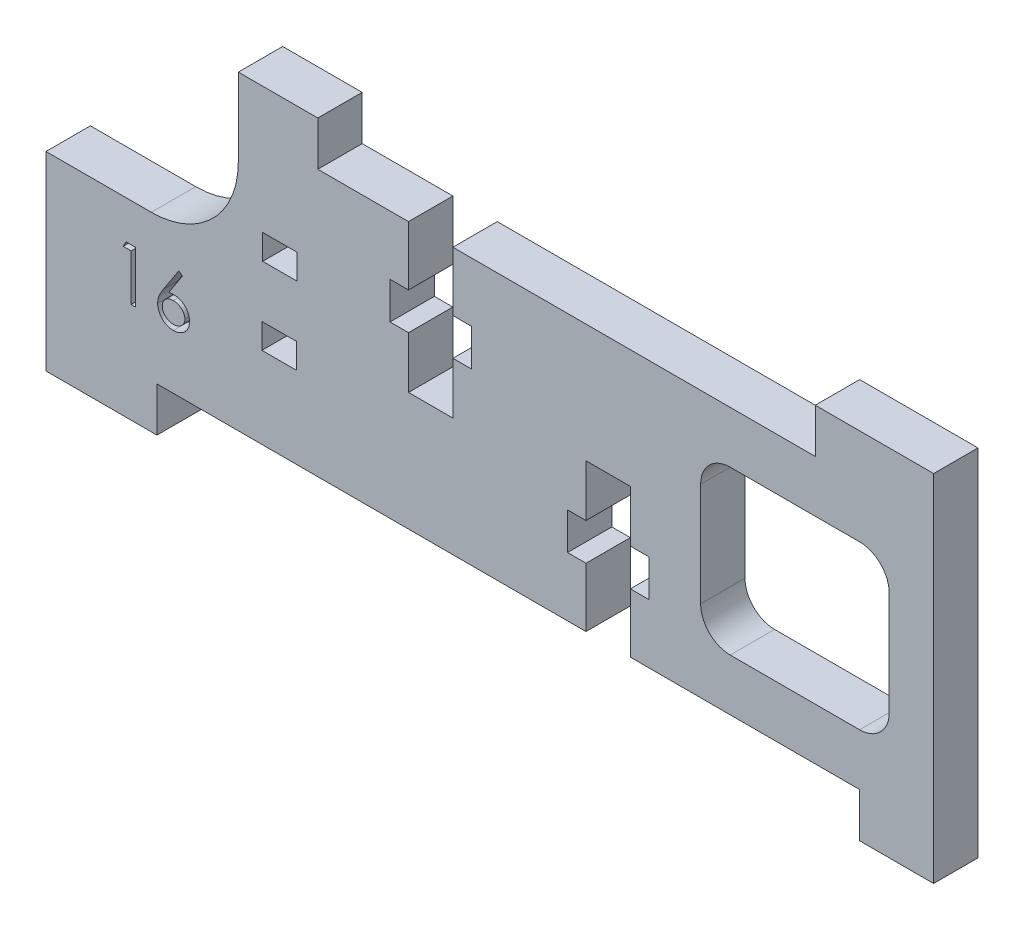
from build123d import *

# Parameters (mm, degrees)
SKETCH_1_W          = 2.3276
SKETCH_1_H          = 1.694
EXTRUDE_1_DEPTH     = 3
CUT_EXTRUDE_1_DEPTH = 1


with BuildPart() as part:
    # 草图1 → 凸台-拉伸1 (new body)
    with BuildSketch(Plane.XY.offset(3)):
        with BuildLine():
            Line((23.2531, 5.583631793), (24.503, 5.583631793))
            Line((24.503, 5.583631793), (24.503, 9.583631793))
            Line((24.503, 9.583631793), (18.3721, 9.583631793))
            Line((18.3721, 9.583631793), (18.3721, 12.583631793))
            Line((18.3721, 12.583631793), (12.9991, 12.583631793))
            Line((12.9991, 12.583631793), (12.9991, 7.316491962))
            ThreePointArc((12.9991, 7.316491962), (11.277392164, 3.159921553), (7.120821755, 1.438213717))
            Line((7.120821755, 1.438213717), (0, 1.438213717))
            Line((0, 1.438213717), (0, -11.416368207))
            Line((0, -11.416368207), (7.4994, -11.416368207))
            Line((7.4994, -11.416368207), (7.4994, -8.416368207))
            Line((7.4994, -8.416368207), (36.5002, -8.416368207))
            Line((36.5002, -8.416368207), (36.5002, -4.416368207))
            Line((36.5002, -4.416368207), (35.2489, -4.416368207))
            Line((35.2489, -4.416368207), (35.2489, -1.916368207))
            Line((35.2489, -1.916368207), (36.5002, -1.916368207))
            Line((36.5002, -1.916368207), (36.5002, 1.583631793))
            Line((36.5002, 1.583631793), (39.5003, 1.583631793))
            Line((39.5003, 1.583631793), (39.5003, -1.916368207))
            Line((39.5003, -1.916368207), (40.7501, -1.916368207))
            Line((40.7501, -1.916368207), (40.7501, -4.416368207))
            Line((40.7501, -4.416368207), (39.5003, -4.416368207))
            Line((39.5003, -4.416368207), (39.5003, -8.416368207))
            Line((39.5003, -8.416368207), (54.9988, -8.416368207))
            Line((54.9988, -8.416368207), (54.9988, -11.416368207))
            Line((54.9988, -11.416368207), (59.9998, -11.416368207))
            Line((59.9998, -11.416368207), (59.9998, 12.583631793))
            Line((59.9998, 12.583631793), (51.9988, 12.583631793))
            Line((51.9988, 12.583631793), (51.9988, 9.583631793))
            Line((51.9988, 9.583631793), (27.5031, 9.583631793))
            Line((27.5031, 9.583631793), (27.5031, 5.583631793))
            Line((27.5031, 5.583631793), (28.7543, 5.583631793))
            Line((28.7543, 5.583631793), (28.7543, 3.083631793))
            Line((28.7543, 3.083631793), (27.5031, 3.083631793))
            Line((27.5031, 3.083631793), (27.5031, -0.416368207))
            Line((27.5031, -0.416368207), (24.503, -0.416368207))
            Line((24.503, -0.416368207), (24.503, 3.083631793))
            Line((24.503, 3.083631793), (23.2531, 3.083631793))
            Line((23.2531, 3.083631793), (23.2531, 5.583631793))
        make_face()
        with BuildLine():
            Line((46.2504, 6.082631793), (54.9998, 6.082631793))
            ThreePointArc((54.9998, 6.082631793), (56.414013562, 5.496845355), (56.9998, 4.082631793))
            Line((56.9998, 4.082631793), (56.9998, -2.916368207))
            ThreePointArc((56.9998, -2.916368207), (56.414013562, -4.330581769), (54.9998, -4.916368207))
            Line((54.9998, -4.916368207), (46.2504, -4.916368207))
            ThreePointArc((46.2504, -4.916368207), (44.836186438, -4.330581769), (44.2504, -2.916368207))
            Line((44.2504, -2.916368207), (44.2504, 4.082631793))
            ThreePointArc((44.2504, 4.082631793), (44.836186438, 5.496845355), (46.2504, 6.082631793))
        make_face(mode=Mode.SUBTRACT)
        with Locations((15.811, 3.177631793)):
            Rectangle(SKETCH_1_W, SKETCH_1_H, mode=Mode.SUBTRACT)
        with Locations((15.7586, -2.060368207)):
            Rectangle(SKETCH_1_W, SKETCH_1_H, mode=Mode.SUBTRACT)
    extrude(amount=-EXTRUDE_1_DEPTH)

    # 草图2 → 切除-拉伸1 (cut)
    # profile 1 of 2: a face of its own
    with BuildSketch(Plane.XY.offset(3)):
        Polygon((5.418488838, -1.146310398), (6.065624255, -1.146310398), (6.065624255, -4.646310398), (5.75152169, -4.646310398), (5.75152169, -1.505284757), (5.213060152, -1.505284757), align=None)
    # profile 2 of 2: a face of its own
    with BuildSketch(Plane.XY.offset(3)):
        with BuildLine():
            Line((8.982290921, -1.056566809), (9.22417794, -1.246570815))
            Line((9.22417794, -1.246570815), (8.299398293, -2.660733475))
            add(Edge.make_bspline(
                [(8.299398293, -2.660733475), (8.36096857, -2.650919615), (8.481068357, -2.63177657), (8.602634255, -2.628618624), (8.661878261, -2.627079629)],
                knots=[0, 0, 0, 0, 1.025318673, 2, 2, 2, 2], degree=3))
            add(Edge.make_bspline(
                [(8.661878261, -2.627079629), (8.697450757, -2.628035741), (8.767474158, -2.629917818), (8.87028096, -2.644401669), (8.969069896, -2.667226781), (9.063431508, -2.700499037), (9.15370449, -2.743001391), (9.240406886, -2.793940261), (9.321908896, -2.855945942), (9.399260075, -2.925210897), (9.469487173, -3.001927882), (9.531663228, -3.083329219), (9.58389002, -3.1693301), (9.626263942, -3.259886966), (9.65916882, -3.354860225), (9.683156465, -3.454128365), (9.697336058, -3.557759836), (9.699261549, -3.628238011), (9.700239639, -3.664038764)],
                knots=[0, 0, 0, 0, 1.04369286, 2.054478336, 3.041073146, 4.015093852, 4.984733326, 5.965804835, 6.960378782, 7.985147595, 9.009457201, 10.008161701, 10.986880575, 11.956520048, 12.937015923, 13.931873656, 14.949455224, 16, 16, 16, 16], degree=3))
            add(Edge.make_bspline(
                [(9.700239639, -3.664038764), (9.698816534, -3.713018468), (9.696016201, -3.809398934), (9.668112405, -3.94977564), (9.62475276, -4.083508155), (9.562775231, -4.208461327), (9.485792849, -4.324463896), (9.391915256, -4.427249362), (9.284471767, -4.518919399), (9.162984969, -4.595576018), (9.032242005, -4.658179069), (8.894890008, -4.703144311), (8.752262861, -4.730827781), (8.655458253, -4.734298384), (8.606489639, -4.736053988)],
                knots=[0, 0, 0, 0, 1.031375318, 2.029502543, 3.004789286, 3.987476834, 4.960371455, 5.9300674, 6.912260825, 7.929083631, 8.949397511, 9.960523116, 10.96833055, 12, 12, 12, 12], degree=3))
            add(Edge.make_bspline(
                [(8.606489639, -4.736053988), (8.559392939, -4.734525782), (8.466102621, -4.731498674), (8.328869826, -4.704532736), (8.197006809, -4.660825634), (8.071437428, -4.600611355), (7.955116815, -4.524553472), (7.851051179, -4.432991193), (7.759759404, -4.327881728), (7.683784783, -4.209241381), (7.623526051, -4.081751423), (7.578336126, -3.948814267), (7.551939883, -3.810914285), (7.548251326, -3.717433146), (7.546393485, -3.67034886)],
                knots=[0, 0, 0, 0, 1.012016664, 2.004627821, 2.994792927, 3.992885782, 4.990978636, 5.973936114, 6.964471063, 7.975201453, 8.993600317, 9.990122807, 10.98767138, 12, 12, 12, 12], degree=3))
            add(Edge.make_bspline(
                [(7.546393485, -3.67034886), (7.54757493, -3.634304277), (7.549987215, -3.560708125), (7.566830606, -3.449244097), (7.5938954, -3.335193015), (7.624205647, -3.238438821), (7.656231257, -3.159177299), (7.682883796, -3.095273809), (7.716057792, -3.029512736), (7.751431174, -2.9596391), (7.792188043, -2.887453667), (7.836503692, -2.811749997), (7.885603343, -2.73373207), (7.920023506, -2.680787874), (7.937619447, -2.653722257)],
                knots=[0, 0, 0, 0, 1.173818275, 2.396712641, 3.66331629, 4.989737886, 5.693666774, 6.447286557, 7.243889047, 8.091586357, 8.998013824, 9.943181721, 10.948533338, 12, 12, 12, 12], degree=3))
            Line((7.937619447, -2.653722257), (8.982290921, -1.056566809))
        make_face()
        with BuildLine():
            add(Edge.make_bspline(
                [(8.595972812, -2.986053988), (8.569310567, -2.986832032), (8.517231458, -2.988351777), (8.440824043, -2.997177029), (8.368510792, -3.013796095), (8.299333658, -3.034962426), (8.234585955, -3.064065486), (8.173797115, -3.099417285), (8.116732064, -3.141038463), (8.063988512, -3.188339374), (8.016168848, -3.240127407), (7.974987718, -3.29559693), (7.939465318, -3.353411133), (7.910583499, -3.414053075), (7.888093423, -3.477499574), (7.871825172, -3.543458824), (7.862771421, -3.61237313), (7.861265189, -3.659105633), (7.860496049, -3.682969052)],
                knots=[0, 0, 0, 0, 1.129588631, 2.206414736, 3.251139165, 4.268635594, 5.265702196, 6.250456724, 7.242448911, 8.251968645, 9.246821453, 10.222880186, 11.173611482, 12.116736599, 13.062300278, 14.020270554, 14.989073742, 16, 16, 16, 16], degree=3))
            add(Edge.make_bspline(
                [(7.860496049, -3.682969052), (7.861122411, -3.706619032), (7.862350613, -3.752993122), (7.873502932, -3.821332301), (7.890538015, -3.88709721), (7.915878411, -3.949948808), (7.946105299, -4.010845127), (7.986010623, -4.067580412), (8.030227409, -4.123600482), (8.083081342, -4.174601954), (8.139804705, -4.222058578), (8.200405908, -4.263538831), (8.263565868, -4.299025005), (8.33013729, -4.326836102), (8.399175674, -4.349660389), (8.471256228, -4.365721868), (8.546429083, -4.374802394), (8.597351021, -4.376310588), (8.623316562, -4.377079629)],
                knots=[0, 0, 0, 0, 0.989467248, 1.94019797, 2.891935182, 3.827694429, 4.772920941, 5.730924762, 6.725747692, 7.756678648, 8.79901574, 9.819492441, 10.826891316, 11.826466727, 12.835195252, 13.867842842, 14.912794438, 16, 16, 16, 16], degree=3))
            add(Edge.make_bspline(
                [(8.623316562, -4.377079629), (8.649282061, -4.376310528), (8.700203915, -4.374802216), (8.775377376, -4.365722547), (8.847455694, -4.349657899), (8.916502203, -4.326845129), (8.983043634, -4.298991519), (9.046148355, -4.263759599), (9.106176449, -4.221803482), (9.162937048, -4.174683053), (9.215570987, -4.123310201), (9.260848266, -4.068080479), (9.299531499, -4.010386584), (9.330965686, -3.950188694), (9.356026977, -3.887059206), (9.373148445, -3.821342482), (9.384277733, -3.752990456), (9.3855091, -3.706618132), (9.386137075, -3.682969052)],
                knots=[0, 0, 0, 0, 1.087397944, 2.132534446, 3.165364764, 4.174271784, 5.174024072, 6.181601208, 7.194203697, 8.236725232, 9.267838612, 10.269026844, 11.221737037, 12.171628256, 13.107553087, 14.05945871, 15.010357665, 16, 16, 16, 16], degree=3))
            add(Edge.make_bspline(
                [(9.386137075, -3.682969052), (9.385586782, -3.659074501), (9.384506736, -3.612177269), (9.372290787, -3.54348965), (9.355348413, -3.477164444), (9.329765383, -3.413618495), (9.296528838, -3.353102568), (9.256045431, -3.295310967), (9.209212861, -3.23980062), (9.155115321, -3.188237811), (9.096225087, -3.141090733), (9.033609502, -3.099471177), (8.968101528, -3.0643462), (8.899767586, -3.035039098), (8.827824703, -3.013889624), (8.753434364, -2.997236381), (8.675645121, -2.988374363), (8.622868513, -2.986837298), (8.595972812, -2.986053988)],
                knots=[0, 0, 0, 0, 0.978206639, 1.919901502, 2.851605144, 3.780102724, 4.718870031, 5.675451981, 6.667674623, 7.690630536, 8.733308323, 9.756129687, 10.767539656, 11.776269907, 12.797430371, 13.836405707, 14.897401972, 16, 16, 16, 16], degree=3))
        make_face(mode=Mode.SUBTRACT)
    extrude(amount=-CUT_EXTRUDE_1_DEPTH, mode=Mode.SUBTRACT)


solid = part.part
